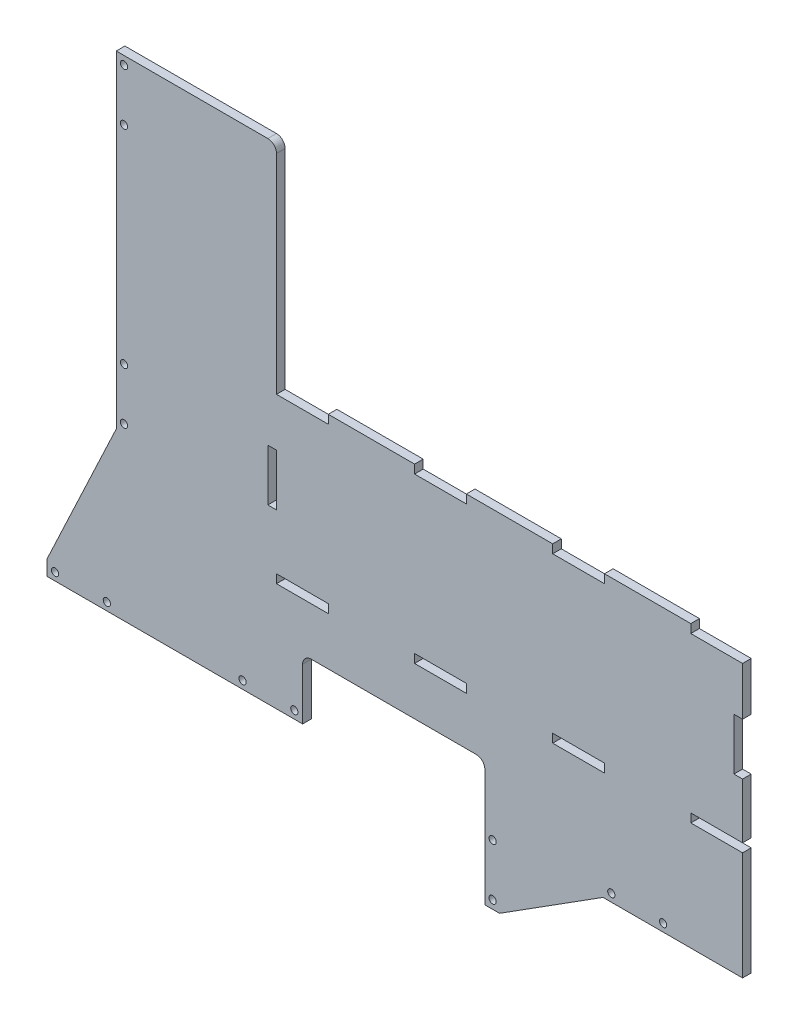
from build123d import *

# Parameters (mm, degrees)
SKETCH1_R           = 2.1
SKETCH1_W           = 30
SKETCH1_H           = 5
SKETCH1_W_2         = 5
SKETCH1_H_2         = 30
BOSS_EXTRUDE1_DEPTH = 5


with BuildPart() as part:
    # Sketch1 → Boss-Extrude1 (new body)
    with BuildSketch(Plane.XY):
        with BuildLine():
            Line((175, 370.830805108), (95.700000001, 370.830805108))
            Line((95.700000001, 370.830805108), (87.2, 370.830805108))
            Line((87.2, 370.830805108), (87.2, 331.230805108))
            Line((87.2, 331.230805108), (87.2, 220.830805108))
            Line((87.2, 220.830805108), (87.2, 181.230805108))
            Line((87.2, 181.230805108), (46.963204669, 95.700000001))
            Line((46.963204669, 95.700000001), (46.963204669, 87.2))
            Line((46.963204669, 87.2), (86.563204669, 87.2))
            Line((86.563204669, 87.2), (155.557214446, 87.2))
            Line((155.557214446, 87.2), (195.157214446, 87.2))
            Line((195.157214446, 87.2), (195.157214446, 117.2))
            ThreePointArc((195.157214446, 117.2), (196.62168054, 120.735533906), (200.157214446, 122.2))
            Line((200.157214446, 122.2), (295.7, 122.2))
            ThreePointArc((295.7, 122.2), (299.235533906, 120.735533906), (300.7, 117.2))
            Line((300.7, 117.2), (300.7, 88.836795331))
            Line((300.7, 88.836795331), (300.7, 49.236795331))
            Line((300.7, 49.236795331), (309.200000001, 49.236795331))
            Line((309.200000001, 49.236795331), (369.169194892, 87.2))
            Line((369.169194892, 87.2), (408.769194892, 87.2))
            Line((408.769194892, 87.2), (450, 87.2))
            Line((450, 87.2), (450, 150))
            Line((450, 150), (420, 150))
            Line((420, 150), (420, 155))
            Line((420, 155), (450, 155))
            Line((450, 155), (450, 187))
            Line((450, 187), (445, 187))
            Line((445, 187), (445, 217))
            Line((445, 217), (450, 217))
            Line((450, 217), (450, 245))
            Line((450, 245), (420, 245))
            Line((420, 245), (420, 250))
            Line((420, 250), (370, 250))
            Line((370, 250), (370, 245))
            Line((370, 245), (340, 245))
            Line((340, 245), (340, 250))
            Line((340, 250), (290, 250))
            Line((290, 250), (290, 245))
            Line((290, 245), (260, 245))
            Line((260, 245), (260, 250))
            Line((260, 250), (210, 250))
            Line((210, 250), (210, 245))
            Line((210, 245), (180, 245))
            Line((180, 245), (180, 365.830805108))
            ThreePointArc((180, 365.830805108), (178.535533906, 369.366339014), (175, 370.830805108))
        make_face()
        with Locations((51.763204669, 91.700000001)):
            Circle(SKETCH1_R, mode=Mode.SUBTRACT)
        with Locations((81.763204669, 91.700000001)):
            Circle(SKETCH1_R, mode=Mode.SUBTRACT)
        with Locations((160.357214446, 91.700000001)):
            Circle(SKETCH1_R, mode=Mode.SUBTRACT)
        with Locations((190.357214446, 91.700000001)):
            Circle(SKETCH1_R, mode=Mode.SUBTRACT)
        with Locations((91.700000001, 186.030805108)):
            Circle(SKETCH1_R, mode=Mode.SUBTRACT)
        with Locations((195, 152.5)):
            Rectangle(SKETCH1_W, SKETCH1_H, mode=Mode.SUBTRACT)
        with Locations((177.5, 202)):
            Rectangle(SKETCH1_W_2, SKETCH1_H_2, mode=Mode.SUBTRACT)
        with Locations((305.200000001, 54.036795331)):
            Circle(SKETCH1_R, mode=Mode.SUBTRACT)
        with Locations((305.200000001, 84.036795331)):
            Circle(SKETCH1_R, mode=Mode.SUBTRACT)
        with Locations((373.969194892, 91.700000001)):
            Circle(SKETCH1_R, mode=Mode.SUBTRACT)
        with Locations((403.969194892, 91.700000001)):
            Circle(SKETCH1_R, mode=Mode.SUBTRACT)
        with Locations((275, 152.5)):
            Rectangle(SKETCH1_W, SKETCH1_H, mode=Mode.SUBTRACT)
        with Locations((355, 152.5)):
            Rectangle(SKETCH1_W, SKETCH1_H, mode=Mode.SUBTRACT)
        with Locations((91.700000001, 216.030805108)):
            Circle(SKETCH1_R, mode=Mode.SUBTRACT)
        with Locations((91.700000001, 336.030805108)):
            Circle(SKETCH1_R, mode=Mode.SUBTRACT)
        with Locations((91.700000001, 366.030805108)):
            Circle(SKETCH1_R, mode=Mode.SUBTRACT)
    extrude(amount=BOSS_EXTRUDE1_DEPTH)


solid = part.part
